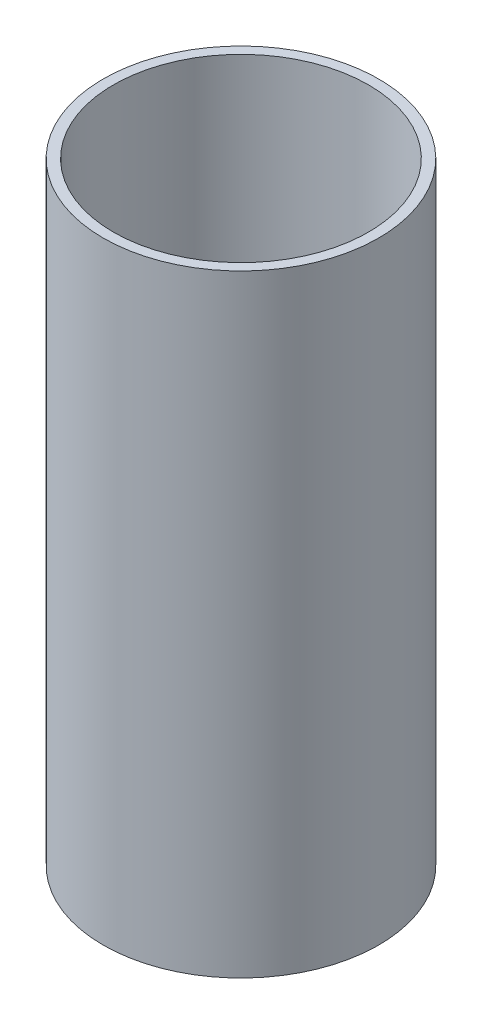
from build123d import *

# Parameters (mm, degrees)
ESBO_O1_R                = 27
ESBO_O1_R_2              = 25
RESSALTO_EXTRUS_O1_DEPTH = 120


with BuildPart() as part:
    # Esboço1 → Ressalto-extrusão1 (new body)
    with BuildSketch(Plane(origin=(0, 0, 0), x_dir=(1, 0, 0), z_dir=(0, 1, 0))):
        with Locations(Location((0, 0, 0), (0, 0, 270))):
            Circle(ESBO_O1_R)
        with Locations(Location((0, 0, 0), (0, 0, 270))):
            Circle(ESBO_O1_R_2, mode=Mode.SUBTRACT)
    extrude(amount=RESSALTO_EXTRUS_O1_DEPTH)


solid = part.part
